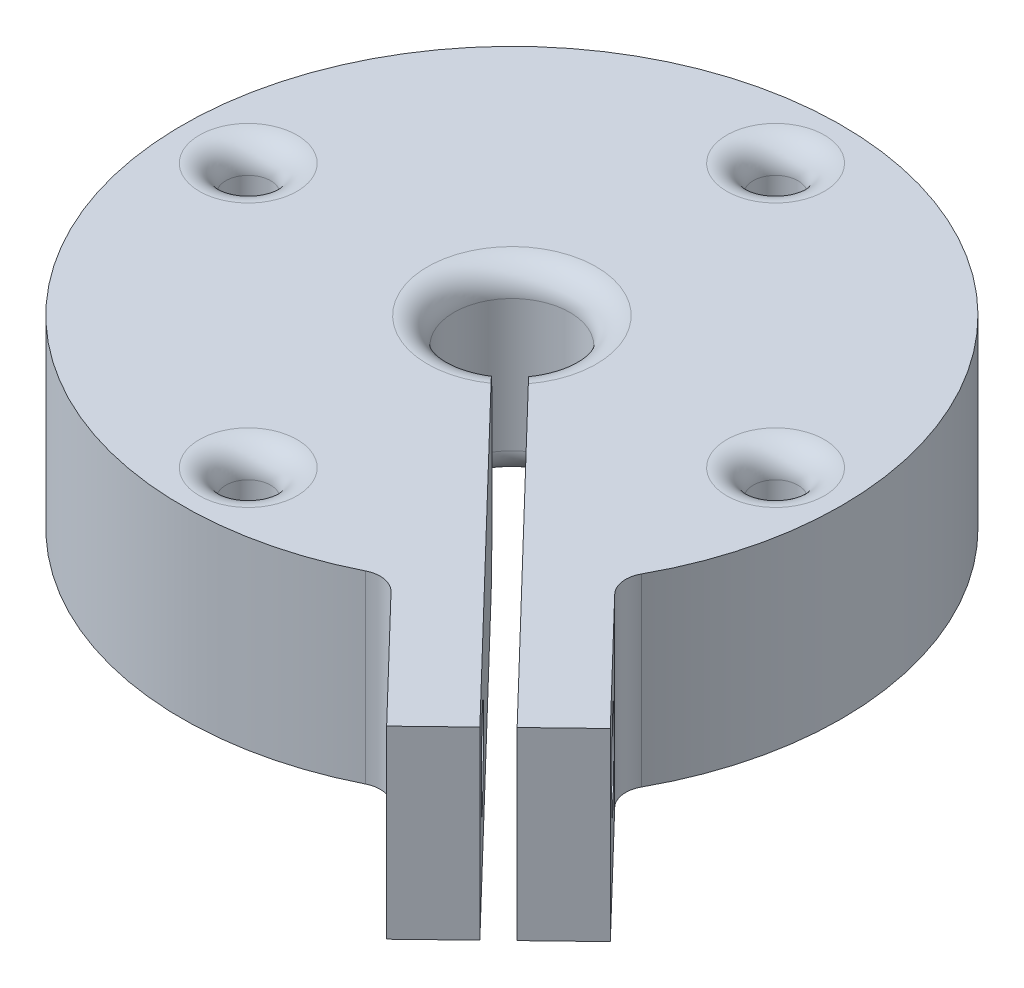
from build123d import *

# Parameters (mm, degrees)
SKETCH_1_R          = 12.5
SKETCH_1_R_2        = 2.2
SKETCH_1_R_3        = 0.85
EXTRUDE_1_DEPTH     = 7
FILLET_1_R          = 1
EXTRUDE_2_DEPTH     = 7
CUT_EXTRUDE_1_DEPTH = 24.213401386
SKETCH_4_R          = 1.6
CUT_EXTRUDE_2_DEPTH = 25.206248906
FILLET_2_R          = 1


with BuildPart() as part:
    # 草图1 → 凸台-拉伸1 (new body)
    with BuildSketch(Plane(origin=(0, 0, 0), x_dir=(1, 0, 0), z_dir=(0, 1, 0))):
        with Locations(Location((0, 0, 0), (0, 0, 270))):
            Circle(SKETCH_1_R)
        with Locations(Location((0, 0, 0), (0, 0, 270))):
            Circle(SKETCH_1_R_2, mode=Mode.SUBTRACT)
        with Locations(Location((0, 10, 0), (0, 0, 270))):
            Circle(SKETCH_1_R_3, mode=Mode.SUBTRACT)
        with Locations(Location((10, 0, 0), (0, 0, 270))):
            Circle(SKETCH_1_R_3, mode=Mode.SUBTRACT)
        with Locations(Location((0, -10, 0), (0, 0, 270))):
            Circle(SKETCH_1_R_3, mode=Mode.SUBTRACT)
        with Locations(Location((-10, 0, 0), (0, 0, 270))):
            Circle(SKETCH_1_R_3, mode=Mode.SUBTRACT)
    extrude(amount=EXTRUDE_1_DEPTH)

    # 圆角1
    fillet_1_edges = [part.edges().sort_by_distance(p)[0] for p in [
        (10, 0, -0.85),
        (10, 7, -0.85),
        (0, 0, 9.15),
        (0, 7, 9.15),
        (-10, 0, -0.85),
        (-10, 7, -0.85),
        (0, 0, -2.2),
        (0, 7, -2.2),
        (0, 0, -10.85),
        (0, 7, -10.85),
    ]]
    fillet(fillet_1_edges, radius=FILLET_1_R)

    # 草图2 → 凸台-拉伸2 (add)
    with BuildSketch(Plane(origin=(0, 7, 0), x_dir=(1, 0, 0), z_dir=(0, 1, 0))):
        Polygon((13.273388675, -13.782322318), (15.434230027, -11.701273386), (10.578449188, -6.659310233), (6.256766485, -10.821408095), (11.112547324, -15.863371249), align=None)
    extrude(amount=-EXTRUDE_2_DEPTH)

    # 草图3 → 切除-拉伸1 (cut, through all)
    with BuildSketch(Plane(origin=(0, 7, 0), x_dir=(1, 0, 0), z_dir=(0, 1, 0))):
        Polygon((13.273388675, -13.782322318), (13.633528901, -13.435480829), (1.082934828, -0.403666798), (0.362654378, -1.097349775), (12.91324845, -14.129163806), align=None)
    extrude(amount=-CUT_EXTRUDE_1_DEPTH, mode=Mode.SUBTRACT)

    # 草图4 → 切除-拉伸2 (cut, through all)
    with BuildSketch(Plane(origin=(2.160841352, 0, -2.081048931), x_dir=(-0.6936829770030817, 0, -0.7202804505303072), z_dir=(0.7202804505303072, 0, -0.6936829770030817))):
        with Locations(Location((-15.532930773, 3.461890088, 0), (0, 0, 180))):
            Circle(SKETCH_4_R)
    extrude(amount=-CUT_EXTRUDE_2_DEPTH, mode=Mode.SUBTRACT)

    # 圆角2
    fillet_2_edges = [part.edges().sort_by_distance(p)[0] for p in [
        (6.256766485, 3.5, 10.821408095),
        (10.578449188, 3.5, 6.659310233),
    ]]
    fillet(fillet_2_edges, radius=FILLET_2_R)


solid = part.part
